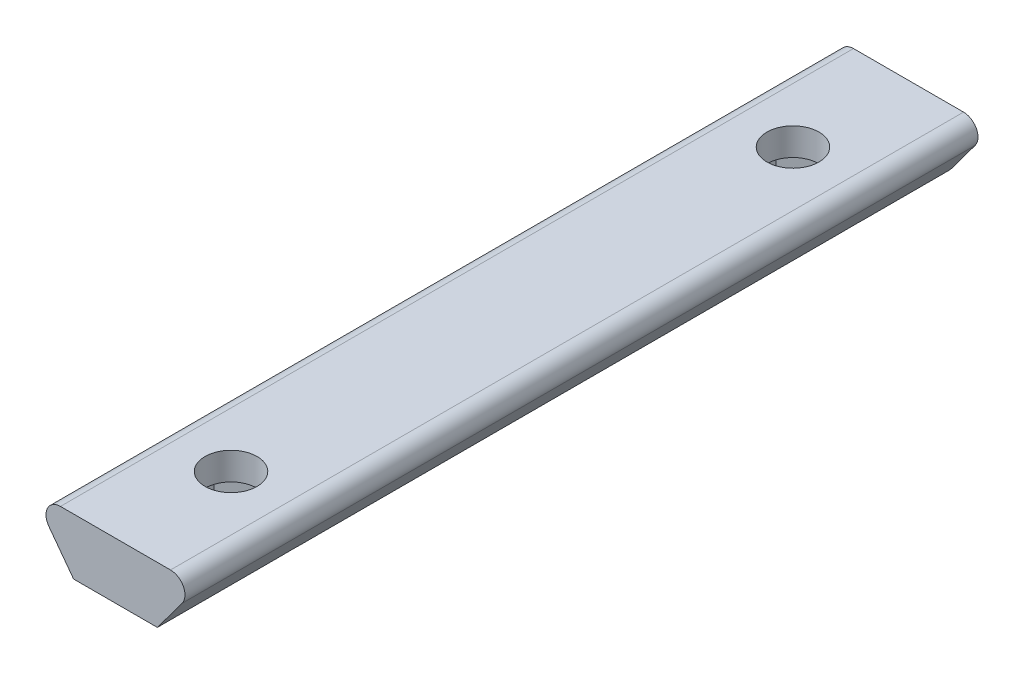
from build123d import *

# Parameters (mm, degrees)
BOSS_EXTRUDE1_DEPTH = 54.9
FILLET1_R           = 1
SKETCH2_R           = 1.8
CUT_EXTRUDE1_DEPTH  = 200
CUT_EXTRUDE2_DEPTH  = 2
LPATTERN1_COUNT     = 2
LPATTERN1_PITCH     = 38.9


with BuildPart() as part:
    # Sketch1 → Boss-Extrude1 (new body)
    with BuildSketch(Plane.XY):
        Polygon((0, 0), (5.8, 0), (8.7, 3.9), (-2.9, 3.9), align=None)
    extrude(amount=BOSS_EXTRUDE1_DEPTH)

    # Fillet1
    fillet1_edges = [part.edges().sort_by_distance(p)[0] for p in [
        (-2.9, 3.9, 27.45),
        (8.7, 3.9, 27.45),
    ]]
    fillet(fillet1_edges, radius=FILLET1_R)

    # Sketch2 → Cut-Extrude1 (cut)
    with BuildSketch(Plane.XZ):
        with Locations(Location((2.9, 46.9, 0), (0, 0, 270))):
            Circle(SKETCH2_R)
    cut_extrude1 = extrude(amount=-CUT_EXTRUDE1_DEPTH, mode=Mode.SUBTRACT)

    # Sketch3 → Cut-Extrude2 (cut)
    with BuildSketch(Plane.XZ):
        Polygon((2.93968596, 43.551603614), (5.819639312, 45.260170857), (5.779953352, 48.608567243), (2.86031404, 50.248396386), (-0.019639312, 48.539829143), (0.020046648, 45.191432757), align=None)
    cut_extrude2 = extrude(amount=-CUT_EXTRUDE2_DEPTH, mode=Mode.SUBTRACT)

    # LPattern1: Cut-Extrude1, Cut-Extrude2 ×2
    with Locations(*[(0, 0, -i * LPATTERN1_PITCH) for i in range(1, LPATTERN1_COUNT)]):
        add(cut_extrude1, mode=Mode.SUBTRACT)
        add(cut_extrude2, mode=Mode.SUBTRACT)


solid = part.part
